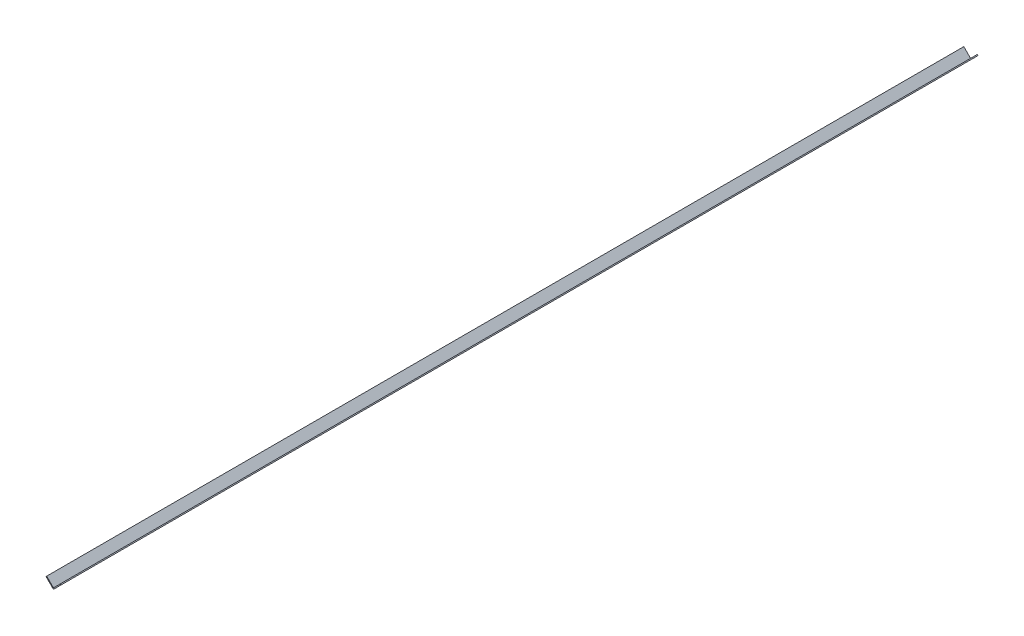
from build123d import *

# Parameters (mm, degrees)
BOSS_EXTRUDE1_DEPTH      = 1143
BOSS_EXTRUDE1_DEPTH_BACK = 76.2


with BuildPart() as part:
    # Sketch1 → Boss-Extrude1 (new, two sides: drawn at the far end of the back side and taken through both)
    with BuildSketch(Plane.XY.offset(-BOSS_EXTRUDE1_DEPTH_BACK)):
        Polygon((0, 0), (-8.980256121, 8.980256121), (-9.878281733, 8.082230509), (0, -1.796051224), (9.878281733, 8.082230509), (8.980256121, 8.980256121), align=None)
    extrude(amount=BOSS_EXTRUDE1_DEPTH + BOSS_EXTRUDE1_DEPTH_BACK)


solid = part.part
